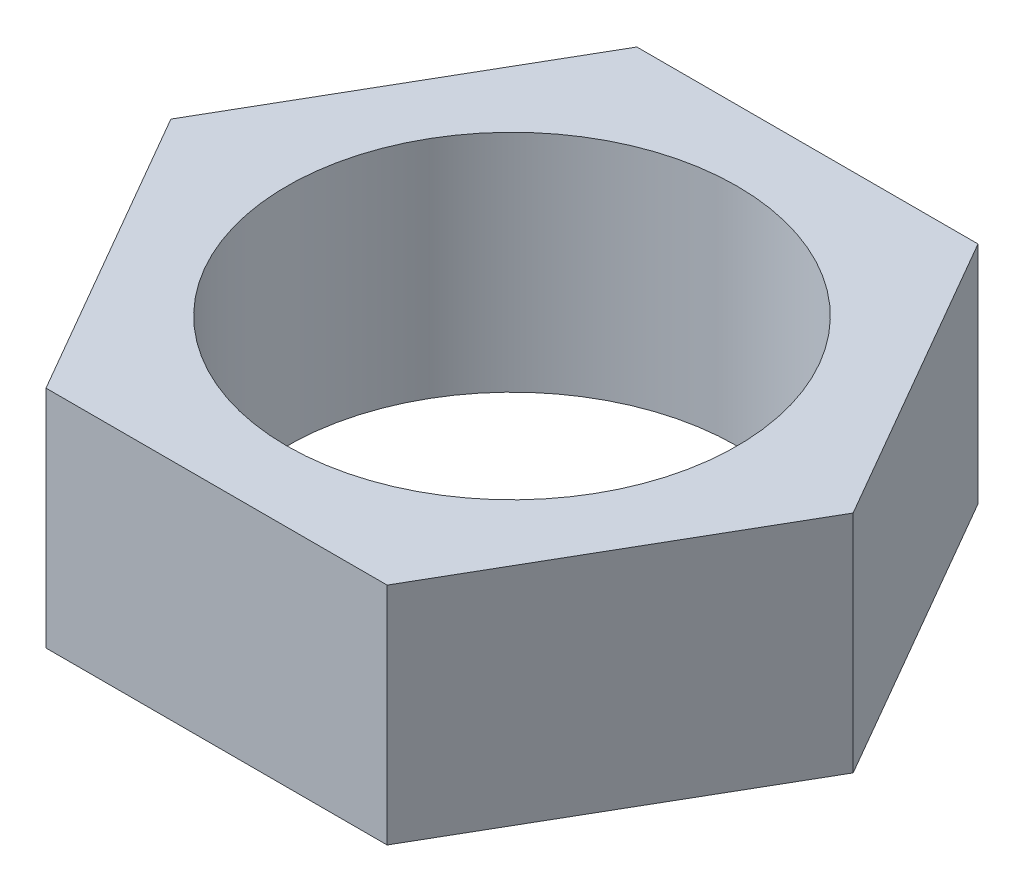
from build123d import *

# Parameters (mm, degrees)
SKETCH1_R           = 12.7
BOSS_EXTRUDE1_DEPTH = 12.7


with BuildPart() as part:
    # Sketch1 → Boss-Extrude1 (new body)
    with BuildSketch(Plane(origin=(0, 0, 0), x_dir=(1, 0, 0), z_dir=(0, 1, 0))):
        Polygon((19.247414599, 0), (9.6237073, 16.66875), (-9.6237073, 16.66875), (-19.247414599, 0), (-9.6237073, -16.66875), (9.6237073, -16.66875), align=None)
        with Locations(Location((0, 0, 0), (0, 0, 270))):
            Circle(SKETCH1_R, mode=Mode.SUBTRACT)
    extrude(amount=BOSS_EXTRUDE1_DEPTH)


solid = part.part
